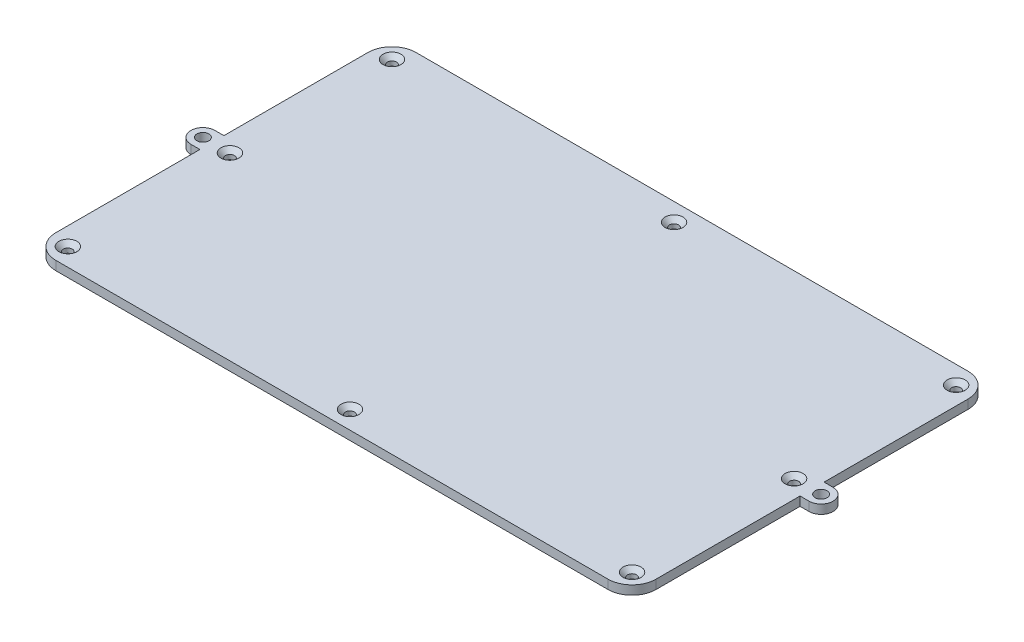
from build123d import *

# Parameters (mm, degrees)
SKETCH1_W                                       = 200
SKETCH1_H                                       = 120
BOSS_EXTRUDE1_DEPTH                             = 3
CSK_FOR_M3_FLAT_HEAD_MACHINE_SCREW1_D           = 3
CSK_FOR_M3_FLAT_HEAD_MACHINE_SCREW1_CSINK_D     = 6
CSK_FOR_M3_FLAT_HEAD_MACHINE_SCREW1_CSINK_ANGLE = 90
FILLET1_R                                       = 8
BOSS_EXTRUDE2_DEPTH                             = 3
SKETCH9_R                                       = 2
CUT_EXTRUDE1_DEPTH                              = 4


with BuildPart() as part:
    # Sketch1 → Boss-Extrude1 (new body)
    with BuildSketch(Plane(origin=(0, 0, 0), x_dir=(1, 0, 0), z_dir=(0, 1, 0))):
        Rectangle(SKETCH1_W, SKETCH1_H)
    extrude(amount=BOSS_EXTRUDE1_DEPTH)

    # CSK for M3 Flat Head Machine Screw1 (through all)
    with Locations(Plane(origin=(0, 3, 0), x_dir=(1, 0, 0), z_dir=(0, 1, 0))):
        with Locations((-94, 54), (0, 54), (94, 54), (94, 0), (94, -54), (0, -54), (-94, -54), (-94, 0)):
            CounterSinkHole(CSK_FOR_M3_FLAT_HEAD_MACHINE_SCREW1_D / 2, CSK_FOR_M3_FLAT_HEAD_MACHINE_SCREW1_CSINK_D / 2, counter_sink_angle=CSK_FOR_M3_FLAT_HEAD_MACHINE_SCREW1_CSINK_ANGLE)

    # Fillet1
    fillet1_edges = [part.edges().sort_by_distance(p)[0] for p in [
        (100, 1.5, 60),
        (-100, 1.5, 60),
        (-100, 1.5, -60),
        (100, 1.5, -60),
    ]]
    fillet(fillet1_edges, radius=FILLET1_R)

    # Sketch7 → Boss-Extrude2 (add)
    with BuildSketch(Plane.XZ):
        with BuildLine():
            Line((100, 4), (103, 4))
            ThreePointArc((103, 4), (107, 0), (103, -4))
            Line((103, -4), (100, -4))
            Line((100, -4), (100, 4))
        make_face()
        with BuildLine():
            Line((-100, -4), (-103, -4))
            ThreePointArc((-103, -4), (-107, 0), (-103, 4))
            Line((-103, 4), (-100, 4))
            Line((-100, 4), (-100, -4))
        make_face()
    extrude(amount=-BOSS_EXTRUDE2_DEPTH)

    # Sketch9 → Cut-Extrude1 (cut)
    with BuildSketch(Plane(origin=(0, 3, 0), x_dir=(1, 0, 0), z_dir=(0, 1, 0))):
        with Locations(Location((-103, 0, 0), (0, 0, 270))):
            Circle(SKETCH9_R)
        with Locations(Location((103, 0, 0), (0, 0, 270))):
            Circle(SKETCH9_R)
    extrude(amount=-CUT_EXTRUDE1_DEPTH, mode=Mode.SUBTRACT)


solid = part.part
